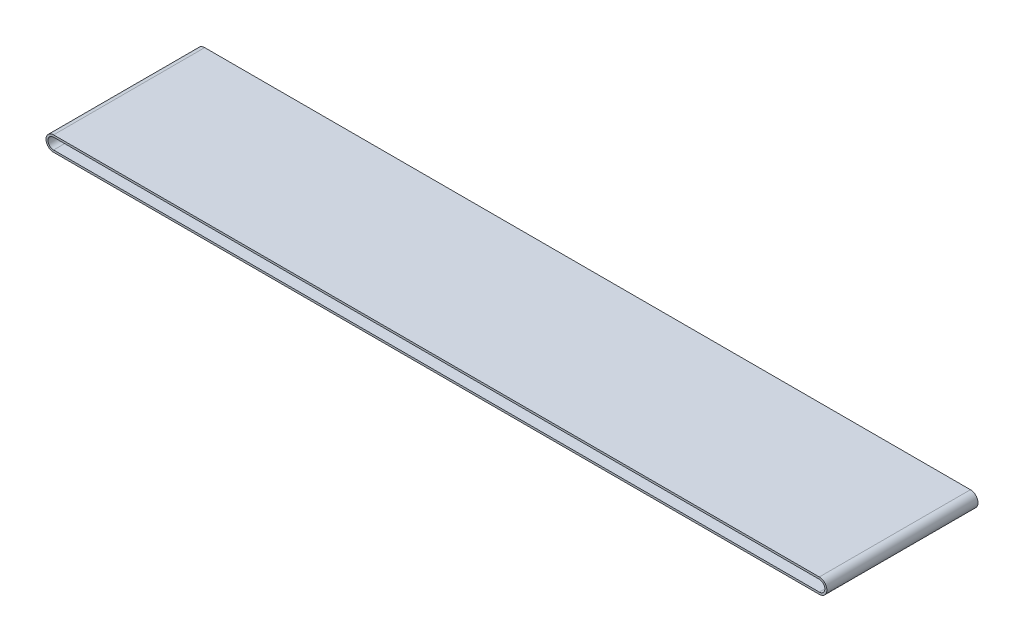
from build123d import *

# Parameters (mm, degrees)
BOSS_EXTRUDE1_DEPTH = 381


with BuildPart() as part:
    # Sketch1 → Boss-Extrude1 (new, symmetric)
    with BuildSketch(Plane.XY):
        with BuildLine():
            Line((0, 38.1), (3860.8, 38.1))
            ThreePointArc((3860.8, 38.1), (3898.9, 0), (3860.8, -38.1))
            Line((3860.8, -38.1), (0, -38.1))
            ThreePointArc((0, -38.1), (-38.1, 0), (0, 38.1))
        make_face()
        with BuildLine():
            Line((0, 27.94), (3860.8, 27.94))
            ThreePointArc((3860.8, 27.94), (3888.74, 0), (3860.8, -27.94))
            Line((3860.8, -27.94), (0, -27.94))
            ThreePointArc((0, -27.94), (-27.94, 0), (0, 27.94))
        make_face(mode=Mode.SUBTRACT)
    extrude(amount=BOSS_EXTRUDE1_DEPTH, both=True)


solid = part.part
